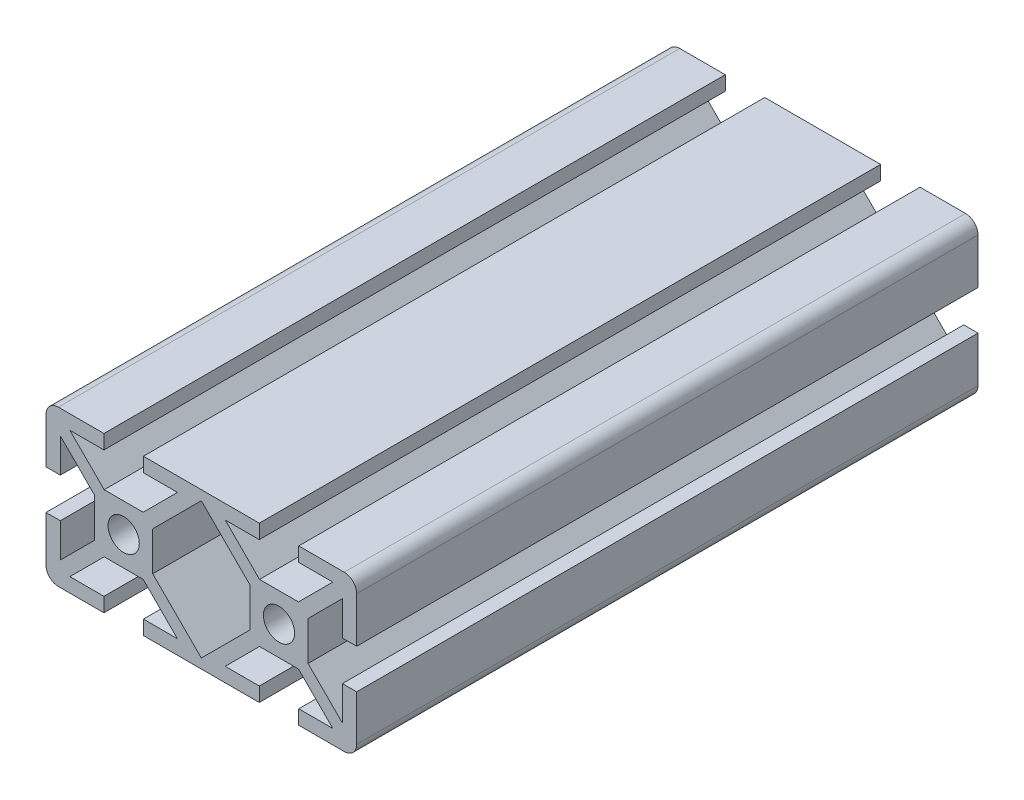
from build123d import *

# Parameters (mm, degrees)
SKETCH1_R      = 2.5527
FINALCUT_DEPTH = 101.6


with BuildPart() as part:
    # Sketch1 → FinalCut (new body)
    with BuildSketch(Plane.XY):
        with BuildLine():
            Line((-17.4498, 0), (-17.4498, 3.187235435))
            Line((-17.4498, 3.187235435), (-23.0632, 8.800635435))
            Line((-23.0632, 8.800635435), (-23.0632, 3.2258))
            Line((-23.0632, 3.2258), (-25.4, 3.2258))
            Line((-25.4, 3.2258), (-25.4, 10.668))
            ThreePointArc((-25.4, 10.668), (-24.804840979, 12.104840979), (-23.368, 12.7))
            Line((-23.368, 12.7), (-15.9258, 12.7))
            Line((-15.9258, 12.7), (-15.9258, 10.3632))
            Line((-15.9258, 10.3632), (-21.500635435, 10.3632))
            Line((-21.500635435, 10.3632), (-15.887235435, 4.7498))
            Line((-15.887235435, 4.7498), (-12.7, 4.7498))
            Line((-12.7, 4.7498), (-9.512764565, 4.7498))
            Line((-9.512764565, 4.7498), (-3.899364565, 10.3632))
            Line((-3.899364565, 10.3632), (-9.4742, 10.3632))
            Line((-9.4742, 10.3632), (-9.4742, 12.7))
            Line((-9.4742, 12.7), (9.4742, 12.7))
            Line((9.4742, 12.7), (9.4742, 10.3632))
            Line((9.4742, 10.3632), (3.899364565, 10.3632))
            Line((3.899364565, 10.3632), (9.512764565, 4.7498))
            Line((9.512764565, 4.7498), (15.887235435, 4.7498))
            Line((15.887235435, 4.7498), (21.500635435, 10.3632))
            Line((21.500635435, 10.3632), (15.9258, 10.3632))
            Line((15.9258, 10.3632), (15.9258, 12.7))
            Line((15.9258, 12.7), (23.368, 12.7))
            ThreePointArc((23.368, 12.7), (24.804840979, 12.104840979), (25.4, 10.668))
            Line((25.4, 10.668), (25.4, 3.2258))
            Line((25.4, 3.2258), (23.0632, 3.2258))
            Line((23.0632, 3.2258), (23.0632, 8.800635435))
            Line((23.0632, 8.800635435), (17.4498, 3.187235435))
            Line((17.4498, 3.187235435), (17.4498, 0))
            Line((17.4498, 0), (17.4498, -3.187235435))
            Line((17.4498, -3.187235435), (23.0632, -8.800635435))
            Line((23.0632, -8.800635435), (23.0632, -3.2258))
            Line((23.0632, -3.2258), (25.4, -3.2258))
            Line((25.4, -3.2258), (25.4, -10.668))
            ThreePointArc((25.4, -10.668), (24.804840979, -12.104840979), (23.368, -12.7))
            Line((23.368, -12.7), (15.9258, -12.7))
            Line((15.9258, -12.7), (15.9258, -10.3632))
            Line((15.9258, -10.3632), (21.500635435, -10.3632))
            Line((21.500635435, -10.3632), (15.887235435, -4.7498))
            Line((15.887235435, -4.7498), (12.7, -4.7498))
            Line((12.7, -4.7498), (9.512764565, -4.7498))
            Line((9.512764565, -4.7498), (3.899364565, -10.3632))
            Line((3.899364565, -10.3632), (9.4742, -10.3632))
            Line((9.4742, -10.3632), (9.4742, -12.7))
            Line((9.4742, -12.7), (-9.4742, -12.7))
            Line((-9.4742, -12.7), (-9.4742, -10.3632))
            Line((-9.4742, -10.3632), (-3.899364565, -10.3632))
            Line((-3.899364565, -10.3632), (-9.512764565, -4.7498))
            Line((-9.512764565, -4.7498), (-12.7, -4.7498))
            Line((-12.7, -4.7498), (-15.887235435, -4.7498))
            Line((-15.887235435, -4.7498), (-21.500635435, -10.3632))
            Line((-21.500635435, -10.3632), (-15.9258, -10.3632))
            Line((-15.9258, -10.3632), (-15.9258, -12.7))
            Line((-15.9258, -12.7), (-23.368, -12.7))
            ThreePointArc((-23.368, -12.7), (-24.804840979, -12.104840979), (-25.4, -10.668))
            Line((-25.4, -10.668), (-25.4, -3.2258))
            Line((-25.4, -3.2258), (-23.0632, -3.2258))
            Line((-23.0632, -3.2258), (-23.0632, -8.800635435))
            Line((-23.0632, -8.800635435), (-17.4498, -3.187235435))
            Line((-17.4498, -3.187235435), (-17.4498, 0))
        make_face()
        with Locations((-12.7, 0)):
            Circle(SKETCH1_R, mode=Mode.SUBTRACT)
        with Locations(Location((12.7, 0, 0), (0, 0, 180))):
            Circle(SKETCH1_R, mode=Mode.SUBTRACT)
        Polygon((7.9502, 3.187235435), (0, 11.137435435), (-7.9502, 3.187235435), (-7.9502, 0), (-7.9502, -3.187235435), (0, -11.137435435), (7.9502, -3.187235435), (7.9502, 0), align=None, mode=Mode.SUBTRACT)
    extrude(amount=-FINALCUT_DEPTH)


solid = part.part
